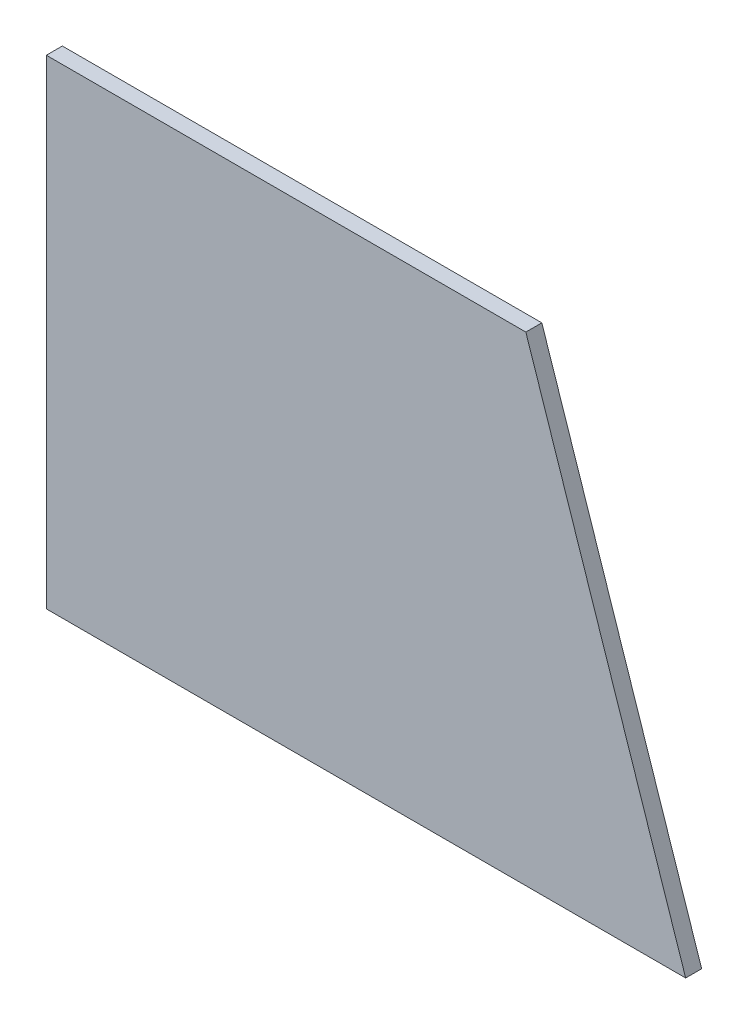
from build123d import *

# Parameters (mm, degrees)
BOSS_EXTRUDE1_DEPTH = 0.01


with BuildPart() as part:
    # Sketch1 → Boss-Extrude1 (new, symmetric)
    with BuildSketch(Plane.XY):
        Polygon((0, 0.6), (0, 0), (0.8, 0), (0.6, 0.6), align=None)
    extrude(amount=BOSS_EXTRUDE1_DEPTH, both=True)


solid = part.part
